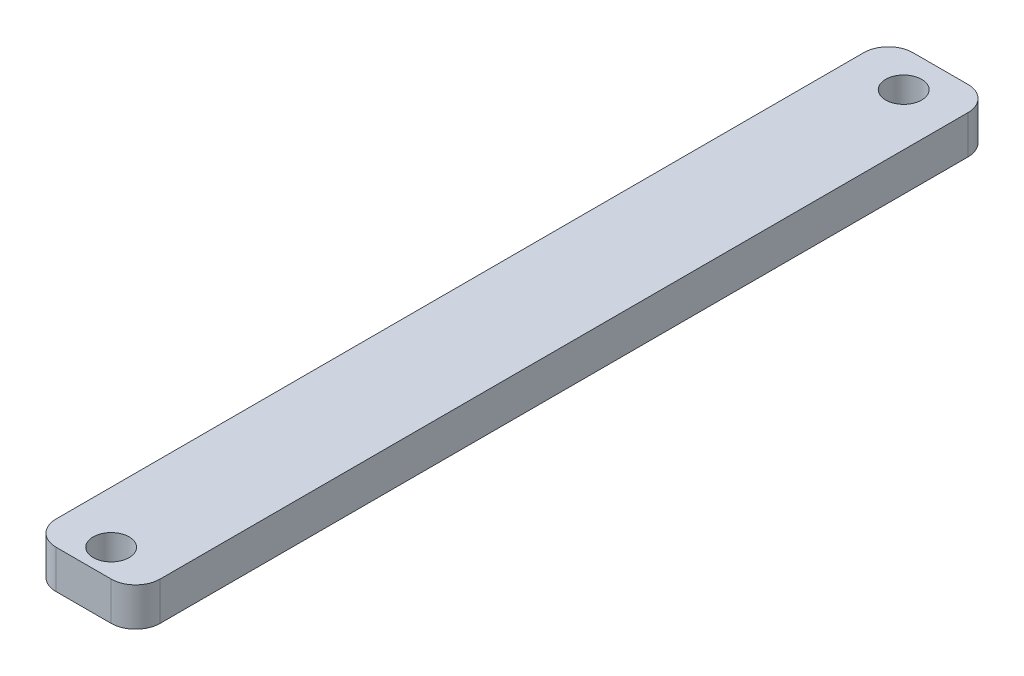
from build123d import *

# Parameters (mm, degrees)
BOSS_EXTRUDE1_DEPTH = 3.14
SKETCH7_R           = 1.47
CUT_EXTRUDE1_DEPTH  = 70.210617683
SKETCH8_W           = 16.5
SKETCH8_H           = 4
CUT_EXTRUDE2_DEPTH  = 70.210617683
FILLET1_R           = 2
SKETCH9_R           = 1.47
CUT_EXTRUDE3_DEPTH  = 70.210617683


with BuildPart() as part:
    # Sketch1 → Boss-Extrude1 (new body)
    with BuildSketch(Plane(origin=(0, 0, 0), x_dir=(1, 0, 0), z_dir=(0, 1, 0))):
        Polygon((12.5, 2), (12.5, -2), (-4, -2), (-4, -68), (-12.5, -68), (-12.5, 2), (-8.5, 2), align=None)
    extrude(amount=BOSS_EXTRUDE1_DEPTH)

    # Sketch7 → Cut-Extrude1 (cut, through all)
    with BuildSketch(Plane(origin=(0, 3.14, 0), x_dir=(1, 0, 0), z_dir=(0, 1, 0))):
        with Locations(Location((-8.25, -65.75, 0), (0, 0, 270))):
            Circle(SKETCH7_R)
    extrude(amount=-CUT_EXTRUDE1_DEPTH, mode=Mode.SUBTRACT)

    # Sketch8 → Cut-Extrude2 (cut, through all)
    with BuildSketch(Plane.XZ):
        with Locations((4.25, 0)):
            Rectangle(SKETCH8_W, SKETCH8_H)
    extrude(amount=-CUT_EXTRUDE2_DEPTH, mode=Mode.SUBTRACT)

    # Fillet1
    fillet1_edges = [part.edges().sort_by_distance(p)[0] for p in [
        (-4, 1.57, 68),
        (-12.5, 1.57, 68),
        (-12.5, 1.57, -2),
        (-4, 1.57, -2),
    ]]
    fillet(fillet1_edges, radius=FILLET1_R)

    # Sketch9 → Cut-Extrude3 (cut, through all)
    with BuildSketch(Plane.XZ):
        with Locations(Location((-8.25, 1, 0), (0, 0, 270))):
            Circle(SKETCH9_R)
    extrude(amount=-CUT_EXTRUDE3_DEPTH, mode=Mode.SUBTRACT)


solid = part.part
